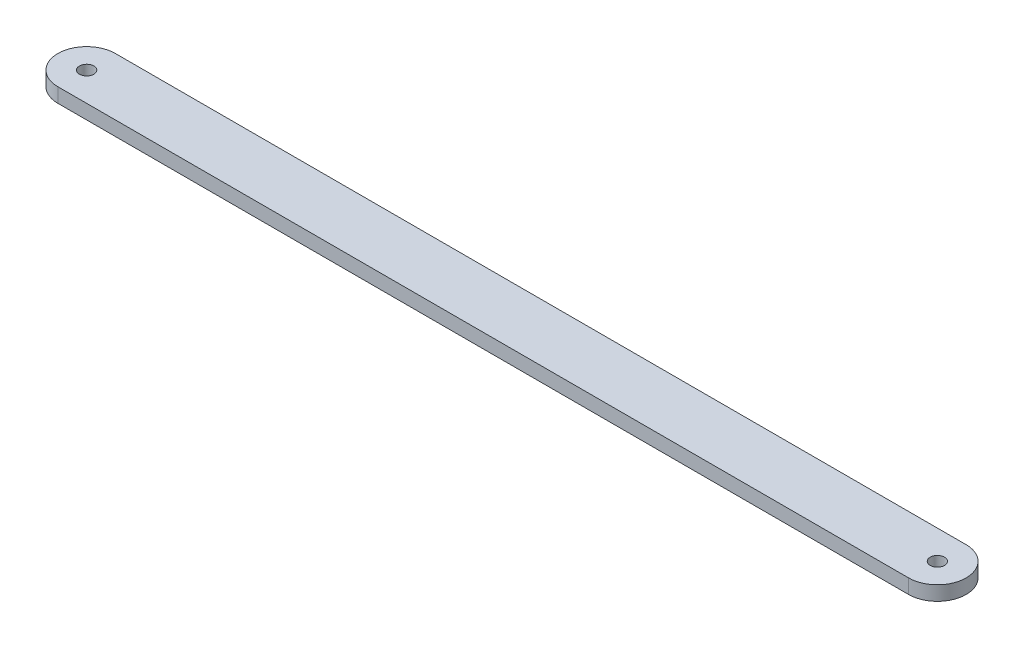
from build123d import *

# Parameters (mm, degrees)
SKETCH_1_R      = 2.5
EXTRUDE_1_DEPTH = 5


with BuildPart() as part:
    # 草圖1 → 填料-伸長1 (new body)
    with BuildSketch(Plane(origin=(0, 0, 0), x_dir=(1, 0, 0), z_dir=(0, 1, 0))):
        with BuildLine():
            Line((-147.85, 10), (147.85, 10))
            ThreePointArc((147.85, 10), (157.85, 0), (147.85, -10))
            Line((147.85, -10), (-147.85, -10))
            ThreePointArc((-147.85, -10), (-157.85, 0), (-147.85, 10))
        make_face()
        with Locations(Location((-147.85, 0, 0), (0, 0, 270))):
            Circle(SKETCH_1_R, mode=Mode.SUBTRACT)
        with Locations(Location((147.85, 0, 0), (0, 0, 270))):
            Circle(SKETCH_1_R, mode=Mode.SUBTRACT)
    extrude(amount=EXTRUDE_1_DEPTH)


solid = part.part
